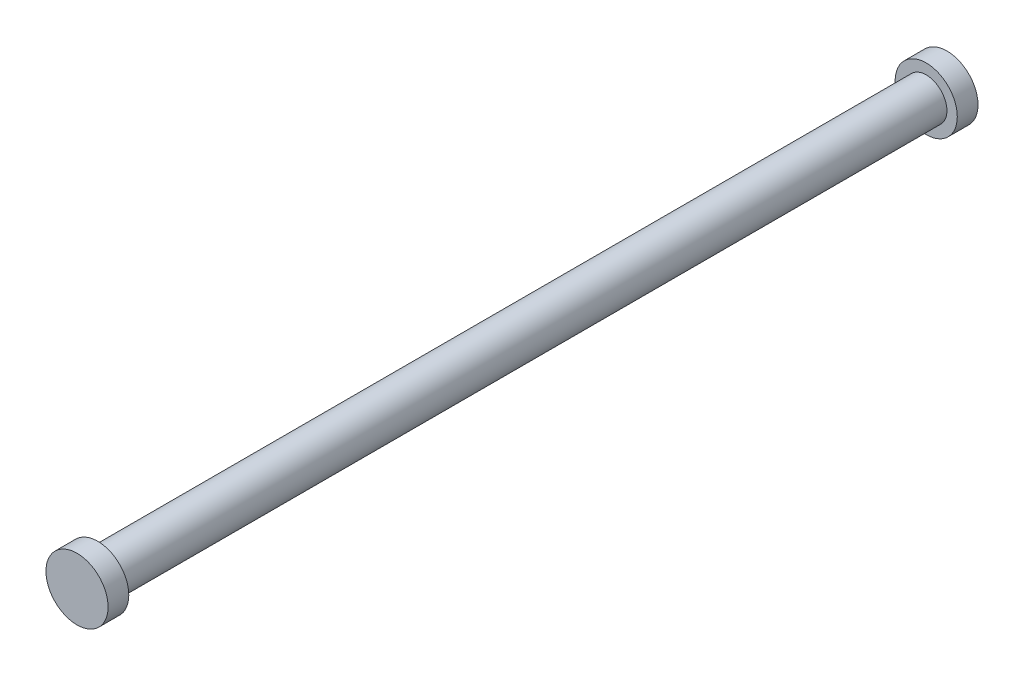
from build123d import *

# Parameters (mm, degrees)
ESQUISSE1_R        = 1
BOSS_EXTRU_1_DEPTH = 40
ESQUISSE2_R        = 1.5
BOSS_EXTRU_2_DEPTH = 1


with BuildPart() as part:
    # Esquisse1 → Boss.-Extru.1 (new body)
    with BuildSketch(Plane.XY):
        Circle(ESQUISSE1_R)
    extrude(amount=BOSS_EXTRU_1_DEPTH)

    # Esquisse2 → Boss.-Extru.2 (add)
    with BuildSketch(Plane.XY.offset(40)):
        Circle(ESQUISSE2_R)
    boss_extru_2 = extrude(amount=BOSS_EXTRU_2_DEPTH)

    # Symétrie1: Boss.-Extru.2 across plane
    add(boss_extru_2.mirror(Plane(origin=(0, 0, 20), x_dir=(1, 0, 0), z_dir=(0, 0, -1))))


solid = part.part
